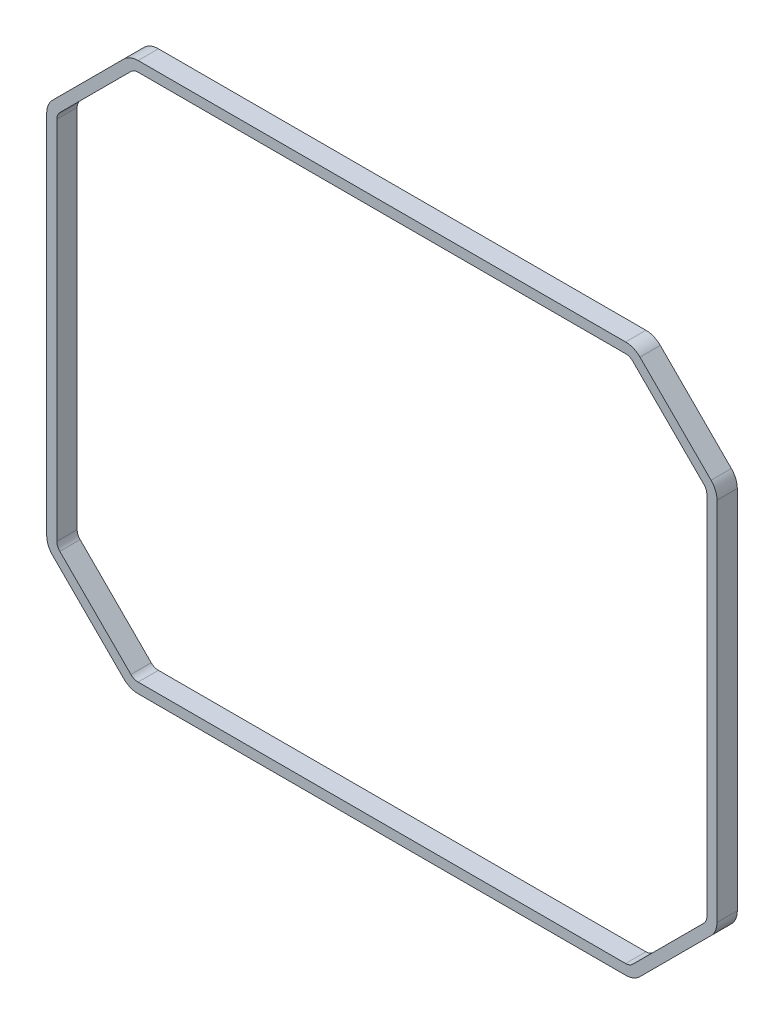
from build123d import *

# Parameters (mm, degrees)
BOSS_EXTRU_1_DEPTH = 2


with BuildPart() as part:
    # Esquisse1 → Boss.-Extru.1 (new body)
    with BuildSketch(Plane.XY):
        with BuildLine():
            Line((-24.001572875, -27), (24.001572875, -27))
            ThreePointArc((24.001572875, -27), (24.76693974, -26.847759065), (25.415786438, -26.414213562))
            Line((25.415786438, -26.414213562), (32.414213562, -19.415786438))
            ThreePointArc((32.414213562, -19.415786438), (32.847759065, -18.76693974), (33, -18.001572875))
            Line((33, -18.001572875), (33, 18.001572875))
            ThreePointArc((33, 18.001572875), (32.847759065, 18.76693974), (32.414213562, 19.415786438))
            Line((32.414213562, 19.415786438), (25.415786438, 26.414213562))
            ThreePointArc((25.415786438, 26.414213562), (24.76693974, 26.847759065), (24.001572875, 27))
            Line((24.001572875, 27), (-24.001572875, 27))
            ThreePointArc((-24.001572875, 27), (-24.76693974, 26.847759065), (-25.415786438, 26.414213562))
            Line((-25.415786438, 26.414213562), (-32.414213562, 19.415786438))
            ThreePointArc((-32.414213562, 19.415786438), (-32.847759065, 18.76693974), (-33, 18.001572875))
            Line((-33, 18.001572875), (-33, -18.001572875))
            ThreePointArc((-33, -18.001572875), (-32.847759065, -18.76693974), (-32.414213562, -19.415786438))
            Line((-32.414213562, -19.415786438), (-25.415786438, -26.414213562))
            ThreePointArc((-25.415786438, -26.414213562), (-24.76693974, -26.847759065), (-24.001572875, -27))
        make_face()
        with BuildLine():
            Line((24.001572875, 26), (-24.001572875, 26))
            ThreePointArc((-24.001572875, 26), (-24.384256308, 25.923879533), (-24.708679656, 25.707106781))
            Line((-24.708679656, 25.707106781), (-31.707106781, 18.708679656))
            ThreePointArc((-31.707106781, 18.708679656), (-31.923879533, 18.384256308), (-32, 18.001572875))
            Line((-32, 18.001572875), (-32, -18.001572875))
            ThreePointArc((-32, -18.001572875), (-31.923879533, -18.384256308), (-31.707106781, -18.708679656))
            Line((-31.707106781, -18.708679656), (-24.708679656, -25.707106781))
            ThreePointArc((-24.708679656, -25.707106781), (-24.384256308, -25.923879533), (-24.001572875, -26))
            Line((-24.001572875, -26), (24.001572875, -26))
            ThreePointArc((24.001572875, -26), (24.384256308, -25.923879533), (24.708679656, -25.707106781))
            Line((24.708679656, -25.707106781), (31.707106781, -18.708679656))
            ThreePointArc((31.707106781, -18.708679656), (31.923879533, -18.384256308), (32, -18.001572875))
            Line((32, -18.001572875), (32, 18.001572875))
            ThreePointArc((32, 18.001572875), (31.923879533, 18.384256308), (31.707106781, 18.708679656))
            Line((31.707106781, 18.708679656), (24.708679656, 25.707106781))
            ThreePointArc((24.708679656, 25.707106781), (24.384256308, 25.923879533), (24.001572875, 26))
        make_face(mode=Mode.SUBTRACT)
    extrude(amount=BOSS_EXTRU_1_DEPTH)


solid = part.part
